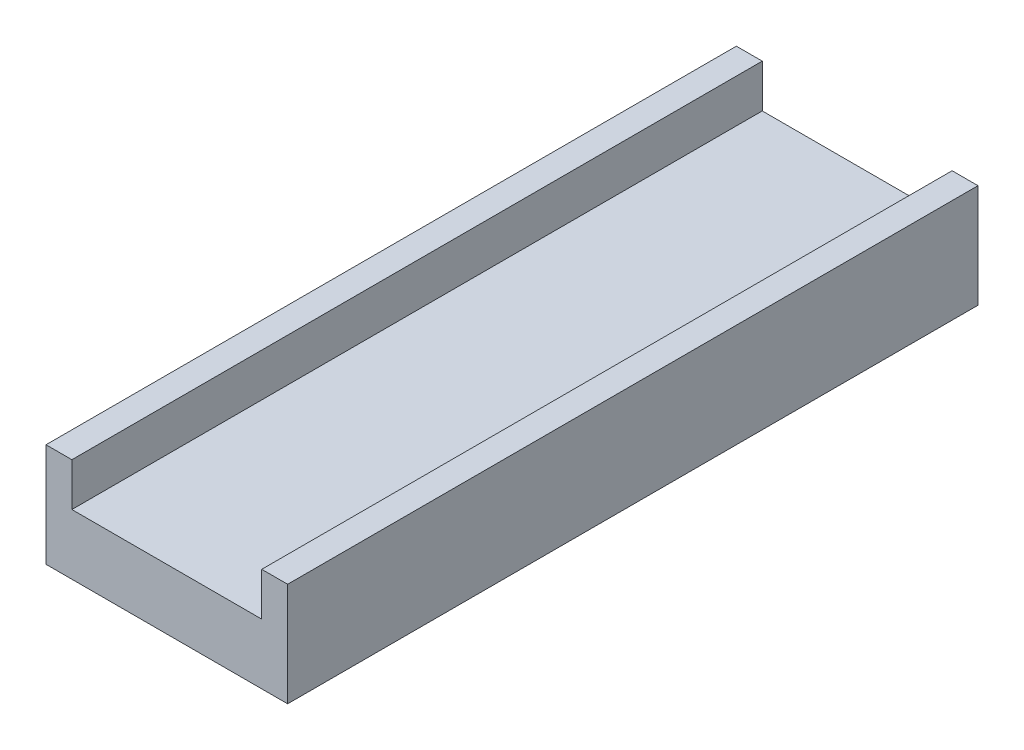
from build123d import *

# Parameters (mm, degrees)
SKETCH1_W           = 28
SKETCH1_H           = 80
BOSS_EXTRUDE1_DEPTH = 2
SKETCH2_W           = 28
SKETCH2_H           = 80
BOSS_EXTRUDE2_DEPTH = 10
SKETCH3_W           = 22
SKETCH3_H           = 80
CUT_EXTRUDE1_DEPTH  = 5


with BuildPart() as part:
    # Sketch1 → Boss-Extrude1 (new body)
    with BuildSketch(Plane(origin=(0, 0, 0), x_dir=(1, 0, 0), z_dir=(0, 1, 0))):
        Rectangle(SKETCH1_W, SKETCH1_H)
    extrude(amount=BOSS_EXTRUDE1_DEPTH)

    # Sketch2 → Boss-Extrude2 (add)
    with BuildSketch(Plane(origin=(0, 2, 0), x_dir=(1, 0, 0), z_dir=(0, 1, 0))):
        Rectangle(SKETCH2_W, SKETCH2_H)
    extrude(amount=BOSS_EXTRUDE2_DEPTH)

    # Sketch3 → Cut-Extrude1 (cut)
    with BuildSketch(Plane(origin=(0, 12, 0), x_dir=(1, 0, 0), z_dir=(0, 1, 0))):
        Rectangle(SKETCH3_W, SKETCH3_H)
    extrude(amount=-CUT_EXTRUDE1_DEPTH, mode=Mode.SUBTRACT)


solid = part.part
